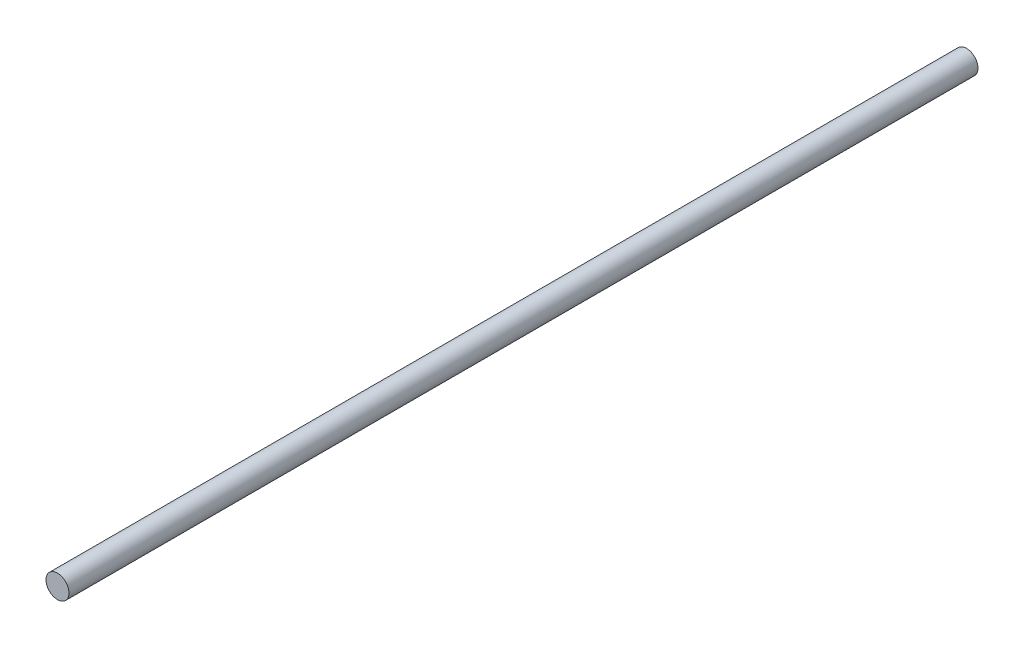
from build123d import *

# Parameters (mm, degrees)
SKETCH1_R           = 4
BOSS_EXTRUDE1_DEPTH = 316


with BuildPart() as part:
    # Sketch1 → Boss-Extrude1 (new body)
    with BuildSketch(Plane(origin=(0, 0, 0), x_dir=(0, 1, 0), z_dir=(0, 0, 1))):
        with Locations(Location((0, 0, 0), (0, 0, 270))):
            Circle(SKETCH1_R)
    extrude(amount=BOSS_EXTRUDE1_DEPTH)


solid = part.part
